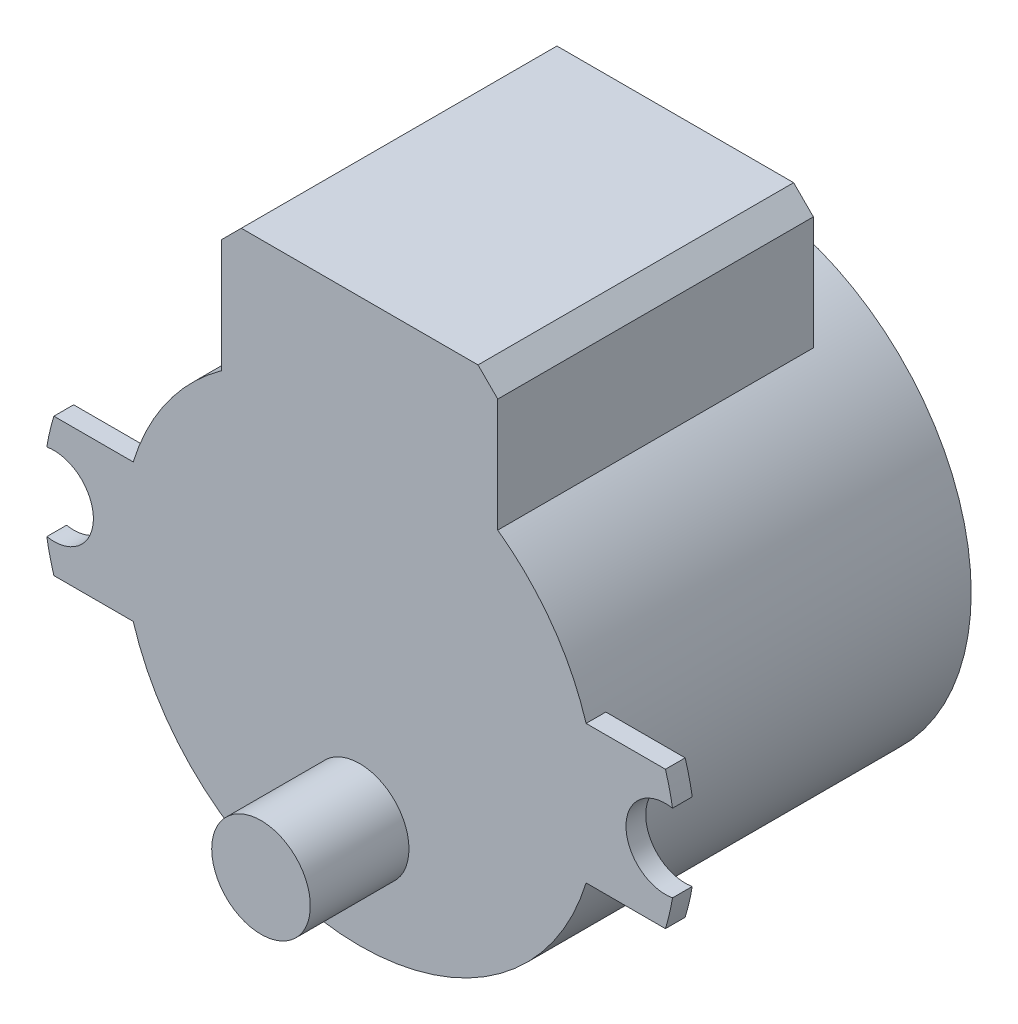
from build123d import *

# Parameters (mm, degrees)
SKETCH_1_W                = 12
SKETCH_1_H                = 19
EXTRUDE_1_REACH           = 37.781
EXTRUDE_1_END_RADIUS      = 12
SKETCH_2_W                = 14
SKETCH_2_H                = 16
EXTRUDE_2_REACH           = 34.679
EXTRUDE_2_START_RADIUS    = 12
EXTRUDE_2_END_RADIUS      = 12
SKETCH_3_W                = 1
SKETCH_3_H                = 7
EXTRUDE_3_REACH           = 34.679
EXTRUDE_3_START_RADIUS    = 12
EXTRUDE_3_END_RADIUS      = 12
SKETCH_4_W                = 1
SKETCH_4_H                = 7
SKETCH_5_W                = 2.5
SKETCH_5_H                = 5
HOLE_WIZARD_4_0_4_1_D     = 4
HOLE_WIZARD_4_0_4_1_DEPTH = 19
CHAMFER_1_SIZE            = 1


with BuildPart() as part:
    # 草图1 → 旋转1 (revolve)
    with BuildSketch(Plane.XZ, mode=Mode.PRIVATE) as revolve_1_sk:
        with Locations((6, -8.5)):
            Rectangle(SKETCH_1_W, SKETCH_1_H)
    revolve(revolve_1_sk.sketch.rotate(Axis((0, 0, 1), (0, 0, -1)), 180), axis=Axis((0, 0, 1), (0, 0, -1)))

    # 凸台-拉伸1: up to this cylinder (the profile starts outside it)
    extrude_1_end = Plane(origin=(0, 0, -7), z_dir=(0, 0, -1)) * Cylinder(EXTRUDE_1_END_RADIUS, 100.562, mode=Mode.PRIVATE)
    # 草图2 → 凸台-拉伸1 (add, up to the surface)
    with BuildSketch(Plane(origin=(0, 16.5, 0), x_dir=(1, 0, 0), z_dir=(0, 1, 0)), mode=Mode.PRIVATE) as extrude_1_sk1:
        with Locations((0, 7)):
            Rectangle(SKETCH_2_W, SKETCH_2_H)
    extrude_1_tool1 = extrude(extrude_1_sk1.sketch, amount=-EXTRUDE_1_REACH, mode=Mode.PRIVATE) - extrude_1_end
    add(extrude_1_tool1.solids().sort_by_distance((0, 16.5, -7))[0])

    # 凸台-拉伸2: from a cylinder face, 34.679 long prism both ways, kept between that surface and its translate by the depth
    extrude_2_start = Plane(origin=(0, 0, 0.5), z_dir=(0, 0, -1)) * Cylinder(EXTRUDE_2_START_RADIUS, 94.358, mode=Mode.PRIVATE)
    extrude_2_end = Plane(origin=(4.021759717, 0, 0.5), z_dir=(0, 0, -1)) * Cylinder(EXTRUDE_2_END_RADIUS, 94.358, mode=Mode.PRIVATE)
    # 草图3 → 凸台-拉伸2 (add, from a surface)
    with BuildSketch(Plane(origin=(-3, 0, 0), x_dir=(0, 0, -1), z_dir=(1, 0, 0)), mode=Mode.PRIVATE) as extrude_2_sk1:
        with Locations((-0.5, 0)):
            Rectangle(SKETCH_3_W, SKETCH_3_H)
    extrude_2_tool1 = extrude(extrude_2_sk1.sketch, amount=EXTRUDE_2_REACH, both=True, mode=Mode.PRIVATE)
    add(((extrude_2_tool1 - extrude_2_start) & extrude_2_end).solids().sort_by_distance((13.48912, 0, 0.5))[0])

    # 凸台-拉伸3: from a cylinder face, 34.679 long prism both ways, kept between that surface and its translate by the depth
    extrude_3_start = Plane(origin=(0, 0, 0.5), z_dir=(0, 0, -1)) * Cylinder(EXTRUDE_3_START_RADIUS, 94.358, mode=Mode.PRIVATE)
    extrude_3_end = Plane(origin=(-4.021759717, 0, 0.5), z_dir=(0, 0, -1)) * Cylinder(EXTRUDE_3_END_RADIUS, 94.358, mode=Mode.PRIVATE)
    # 草图4 → 凸台-拉伸3 (add, from a surface)
    with BuildSketch(Plane.ZY.offset(-3), mode=Mode.PRIVATE) as extrude_3_sk1:
        with Locations((0.5, 0)):
            Rectangle(SKETCH_4_W, SKETCH_4_H)
    extrude_3_tool1 = extrude(extrude_3_sk1.sketch, amount=EXTRUDE_3_REACH, both=True, mode=Mode.PRIVATE)
    add(((extrude_3_tool1 - extrude_3_start) & extrude_3_end).solids().sort_by_distance((-13.48912, 0, 0.5))[0])

    # 草图5 → 旋转2 (revolve)
    with BuildSketch(Plane.XZ.offset(6.5), mode=Mode.PRIVATE) as revolve_2_sk:
        with Locations((1.25, 3.5)):
            Rectangle(SKETCH_5_W, SKETCH_5_H)
    revolve(revolve_2_sk.sketch.rotate(Axis((0, -6.5, 6), (0, 0, -1)), 180), axis=Axis((0, -6.5, 6), (0, 0, -1)))

    # Ø4.0 (4) 直径孔1
    with Locations(Plane.XY.offset(1)):
        with Locations((-15.5, 0), (15.5, 0)):
            Hole(HOLE_WIZARD_4_0_4_1_D / 2, depth=HOLE_WIZARD_4_0_4_1_DEPTH)

    # 倒角1
    chamfer_1_edges = [part.edges().sort_by_distance(p)[0] for p in [
        (-7, 16.5, -7),
        (7, 16.5, -7),
    ]]
    chamfer(chamfer_1_edges, length=CHAMFER_1_SIZE)


solid = part.part
